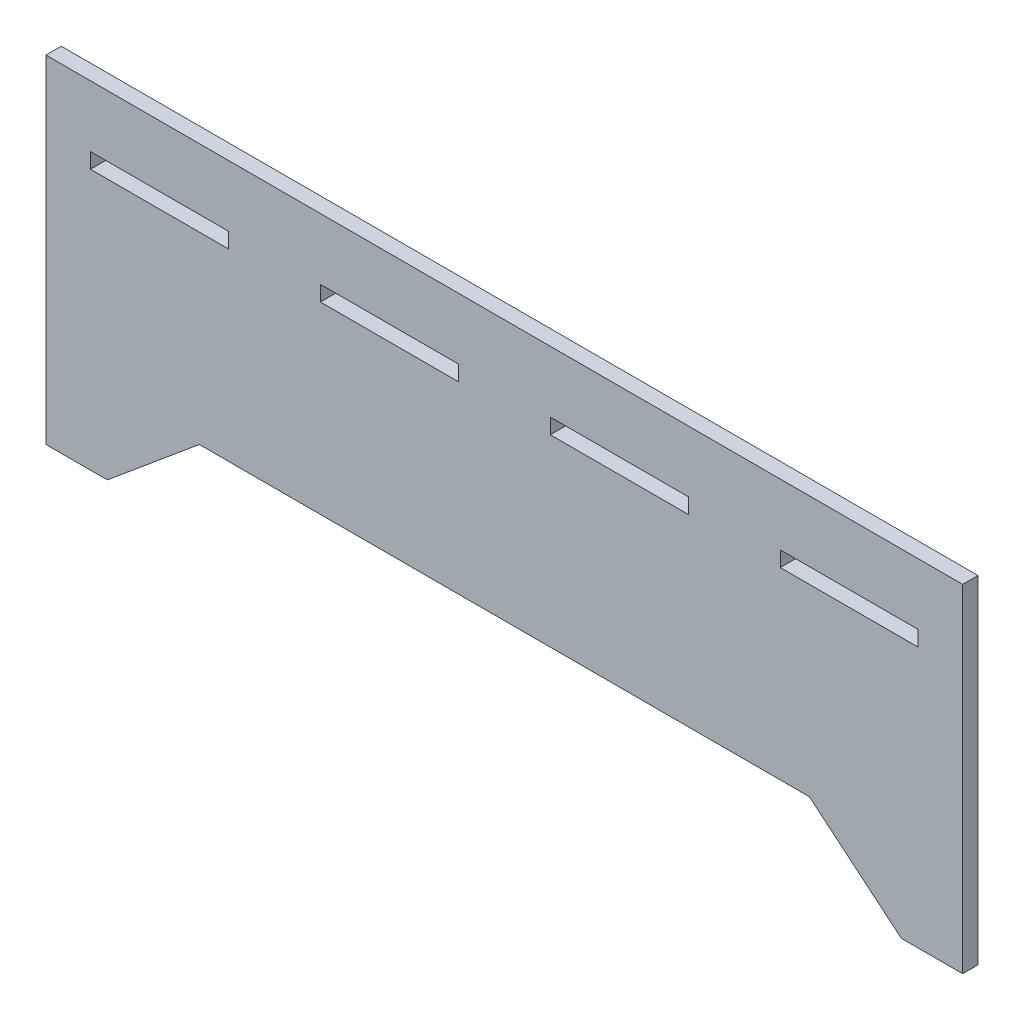
from build123d import *

# Parameters (mm, degrees)
ESQUISSE1_W        = 90
ESQUISSE1_H        = 10
BOSS_EXTRU_1_DEPTH = 10


with BuildPart() as part:
    # Esquisse1 → Boss.-Extru.1 (new body)
    with BuildSketch(Plane.XY):
        Polygon((0, 170), (598, 170), (598, 0), (598, -50), (558, -50), (498, 0), (100, 0), (40, -50), (0, -50), (0, 0), align=None)
        with Locations((224, 125)):
            Rectangle(ESQUISSE1_W, ESQUISSE1_H, mode=Mode.SUBTRACT)
        with Locations((374, 125)):
            Rectangle(ESQUISSE1_W, ESQUISSE1_H, mode=Mode.SUBTRACT)
        with Locations((74, 125)):
            Rectangle(ESQUISSE1_W, ESQUISSE1_H, mode=Mode.SUBTRACT)
        with Locations((524, 125)):
            Rectangle(ESQUISSE1_W, ESQUISSE1_H, mode=Mode.SUBTRACT)
    extrude(amount=BOSS_EXTRU_1_DEPTH)


solid = part.part
